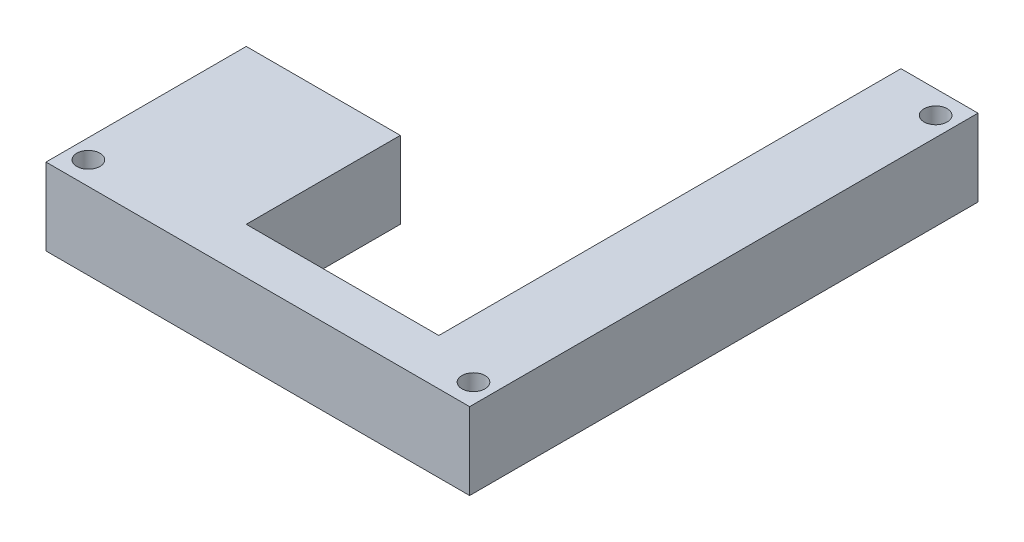
from build123d import *

# Parameters (mm, degrees)
ESQUISSE1_R        = 1.5
BOSS_EXTRU_1_DEPTH = 10


with BuildPart() as part:
    # Esquisse1 → Boss.-Extru.1 (new body)
    with BuildSketch(Plane(origin=(0, 0, 0), x_dir=(1, 0, 0), z_dir=(0, 1, 0))):
        Polygon((5.288808664, 30.508122744), (15.288808664, 30.508122744), (15.288808664, -35.491877256), (-39.711191336, -35.491877256), (-39.711191336, -9.491877256), (-19.711191336, -9.491877256), (-19.711191336, -29.491877256), (5.288808664, -29.491877256), align=None)
        with Locations(Location((12.788808664, -32.491877256, 0), (0, 0, 270))):
            Circle(ESQUISSE1_R, mode=Mode.SUBTRACT)
        with Locations(Location((-37.211191336, -32.491877256, 0), (0, 0, 270))):
            Circle(ESQUISSE1_R, mode=Mode.SUBTRACT)
        with Locations(Location((12.788808664, 27.508122744, 0), (0, 0, 270))):
            Circle(ESQUISSE1_R, mode=Mode.SUBTRACT)
    extrude(amount=BOSS_EXTRU_1_DEPTH)


solid = part.part
